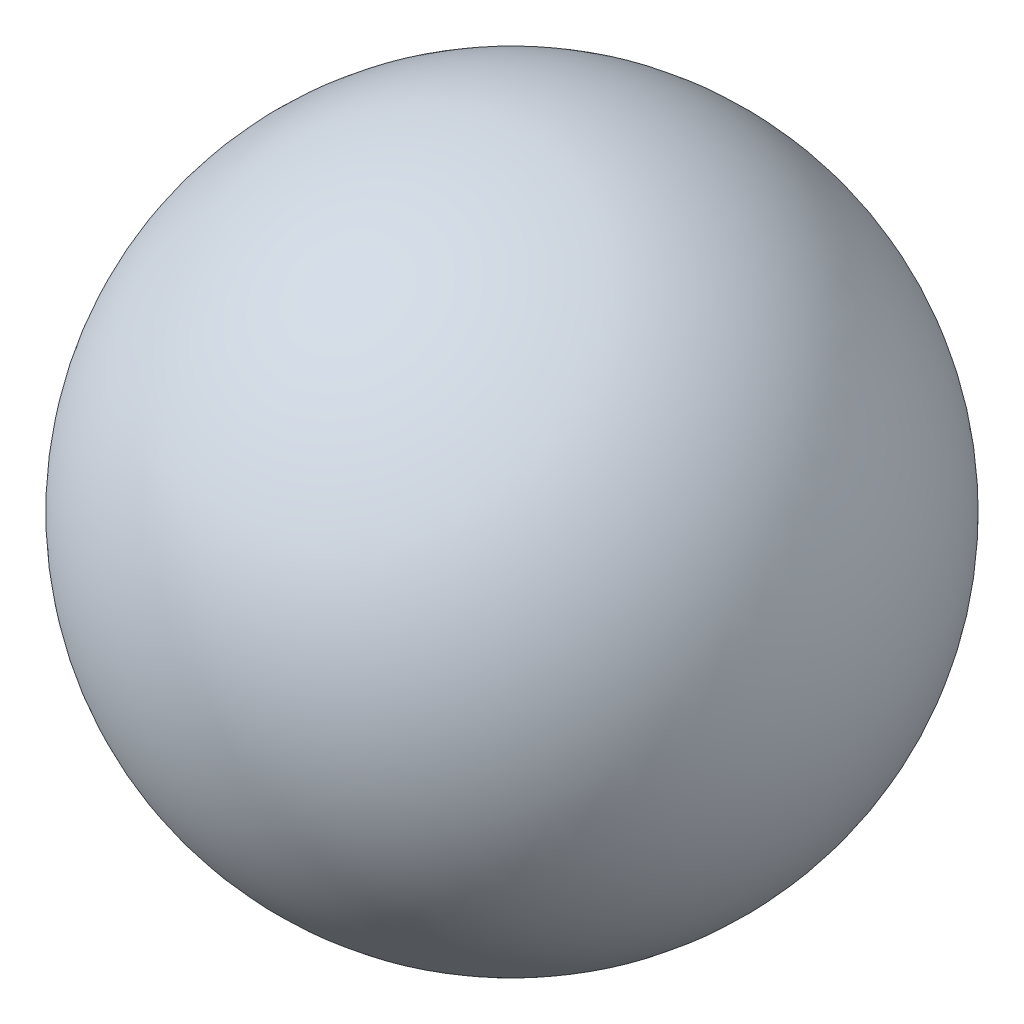
from build123d import *


with BuildPart() as part:
    # Sketch1 → Revolve1 (revolve)
    with BuildSketch(Plane.XY):
        with BuildLine():
            Line((0, 0), (0, 50))
            ThreePointArc((0, 50), (25, 25), (0, 0))
        make_face()
    revolve(axis=Axis((0, 0, 0), (0, 1, 0)))


solid = part.part
